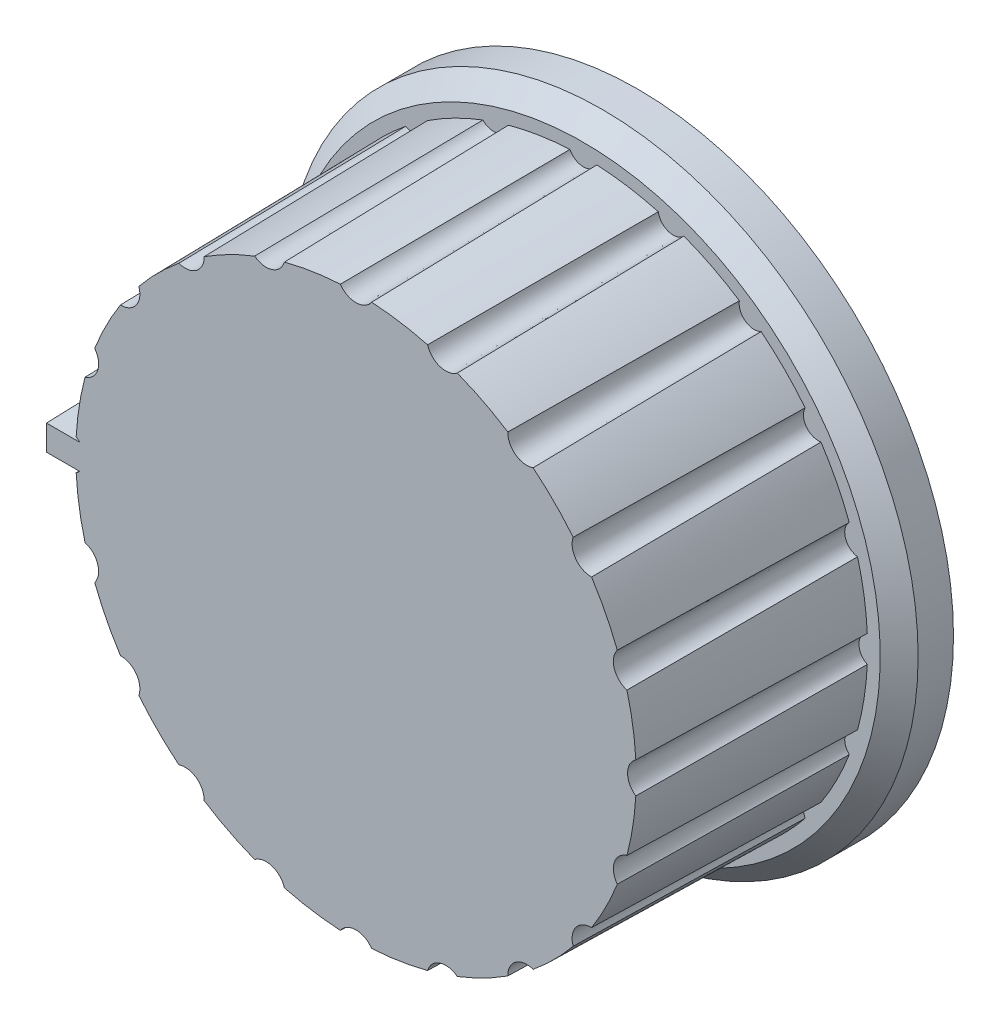
from build123d import *

# Parameters (mm, degrees)
SKETCH1_R                     = 25
BOSS_EXTRUDE1_DEPTH           = 4.3
SKETCH2_R                     = 22.5
BOSS_EXTRUDE2_DEPTH           = 18
BOSS_EXTRUDE2_TAPER           = 1
CHAMFER1_SIZE                 = 1.5
SKETCH3_R                     = 1.5
CUT_EXTRUDE2_DEPTH            = 18
CUT_EXTRUDE2_DRAFT            = -1
CUT_EXTRUDE2_PROFILE_2_DEPTH  = 18
CUT_EXTRUDE2_PROFILE_2_DRAFT  = -1
CUT_EXTRUDE2_PROFILE_3_DEPTH  = 18
CUT_EXTRUDE2_PROFILE_3_DRAFT  = -1
CUT_EXTRUDE2_PROFILE_4_DEPTH  = 18
CUT_EXTRUDE2_PROFILE_4_DRAFT  = -1
CUT_EXTRUDE2_PROFILE_5_DEPTH  = 18
CUT_EXTRUDE2_PROFILE_5_DRAFT  = -1
CUT_EXTRUDE2_PROFILE_6_DEPTH  = 18
CUT_EXTRUDE2_PROFILE_6_DRAFT  = -1
CUT_EXTRUDE2_PROFILE_7_DEPTH  = 18
CUT_EXTRUDE2_PROFILE_7_DRAFT  = -1
CUT_EXTRUDE2_PROFILE_8_DEPTH  = 18
CUT_EXTRUDE2_PROFILE_8_DRAFT  = -1
CUT_EXTRUDE2_PROFILE_9_DEPTH  = 18
CUT_EXTRUDE2_PROFILE_9_DRAFT  = -1
CUT_EXTRUDE2_PROFILE_10_DEPTH = 18
CUT_EXTRUDE2_PROFILE_10_DRAFT = -1
CUT_EXTRUDE2_PROFILE_11_DEPTH = 18
CUT_EXTRUDE2_PROFILE_11_DRAFT = -1
CUT_EXTRUDE2_PROFILE_12_DEPTH = 18
CUT_EXTRUDE2_PROFILE_12_DRAFT = -1
CUT_EXTRUDE2_PROFILE_13_DEPTH = 18
CUT_EXTRUDE2_PROFILE_13_DRAFT = -1
CUT_EXTRUDE2_PROFILE_14_DEPTH = 18
CUT_EXTRUDE2_PROFILE_14_DRAFT = -1
CUT_EXTRUDE2_PROFILE_15_DEPTH = 18
CUT_EXTRUDE2_PROFILE_15_DRAFT = -1
CUT_EXTRUDE2_PROFILE_16_DEPTH = 18
CUT_EXTRUDE2_PROFILE_16_DRAFT = -1
CUT_EXTRUDE2_PROFILE_17_DEPTH = 18
CUT_EXTRUDE2_PROFILE_17_DRAFT = -1
CUT_EXTRUDE2_PROFILE_18_DEPTH = 18
CUT_EXTRUDE2_PROFILE_18_DRAFT = -1
CUT_EXTRUDE2_PROFILE_19_DEPTH = 18
CUT_EXTRUDE2_PROFILE_19_DRAFT = -1
CUT_EXTRUDE2_PROFILE_20_DEPTH = 18
CUT_EXTRUDE2_PROFILE_20_DRAFT = -1
SKETCH4_W                     = 7
SKETCH4_H                     = 2
BOSS_EXTRUDE3_DEPTH           = 21
BOSS_EXTRUDE3_DRAFT           = 1
SKETCH5_R                     = 5.9
CUT_EXTRUDE3_DEPTH            = 3
SKETCH7_R                     = 3
CUT_EXTRUDE4_DEPTH            = 11
SKETCH8_W                     = 5.946427498
SKETCH8_H                     = 0.8
BOSS_EXTRUDE4_DEPTH           = 12


with BuildPart() as part:
    # Sketch1 → Boss-Extrude1 (new body)
    with BuildSketch(Plane.XY):
        with Locations(Location((0, 0, 0), (0, 0, 180))):
            Circle(SKETCH1_R)
    extrude(amount=BOSS_EXTRUDE1_DEPTH)

    # Sketch2 → Boss-Extrude2 (add)
    with BuildSketch(Plane.XY.offset(4.3)):
        Circle(SKETCH2_R)
    extrude(amount=BOSS_EXTRUDE2_DEPTH, taper=BOSS_EXTRUDE2_TAPER)

    # Chamfer1
    chamfer1_edges = [part.edges().sort_by_distance(p)[0] for p in [
        (25, 0, 4.3),
    ]]
    chamfer(chamfer1_edges, length=CHAMFER1_SIZE)


with BuildPart() as cut_extrude2_tool:
    # Sketch3 → Cut-Extrude2 (with draft: the straight prism first)
    with BuildSketch(Plane.XY.offset(22.3)):
        with Locations((0, 23)):
            Circle(SKETCH3_R)
    extrude(amount=-CUT_EXTRUDE2_DEPTH)
    # Cut-Extrude2: the draft: its side faces are tilted about the plane it starts from
    cut_extrude2_sides = [cut_extrude2_tool.faces().sort_by_distance(p)[0] for p in [
        (-1.5, 23, 13.3),
    ]]
    draft(cut_extrude2_sides, Plane.XY.offset(22.3), CUT_EXTRUDE2_DRAFT)


with BuildPart() as part_1:
    add(part.part)

    # Cut-Extrude2: cut by cut_extrude2_tool
    add(cut_extrude2_tool.part, mode=Mode.SUBTRACT)


with BuildPart() as cut_extrude2_profile_2_tool:
    # Sketch3 → Cut-Extrude2 profile 2 (with draft: the straight prism first)
    with BuildSketch(Plane.XY.offset(22.3)):
        with Locations((7.107390871, 21.874299875)):
            Circle(SKETCH3_R)
    extrude(amount=-CUT_EXTRUDE2_PROFILE_2_DEPTH)
    # Cut-Extrude2 profile 2: the draft: its side faces are tilted about the plane it starts from
    cut_extrude2_profile_2_sides = [cut_extrude2_profile_2_tool.faces().sort_by_distance(p)[0] for p in [
        (5.607390871, 21.874299875, 13.3),
    ]]
    draft(cut_extrude2_profile_2_sides, Plane.XY.offset(22.3), CUT_EXTRUDE2_PROFILE_2_DRAFT)


with BuildPart() as part_2:
    add(part_1.part)

    # Cut-Extrude2 profile 2: cut by cut_extrude2_profile_2_tool
    add(cut_extrude2_profile_2_tool.part, mode=Mode.SUBTRACT)


with BuildPart() as cut_extrude2_profile_3_tool:
    # Sketch3 → Cut-Extrude2 profile 3 (with draft: the straight prism first)
    with BuildSketch(Plane.XY.offset(22.3)):
        with Locations((13.519060803, 18.607390871)):
            Circle(SKETCH3_R)
    extrude(amount=-CUT_EXTRUDE2_PROFILE_3_DEPTH)
    # Cut-Extrude2 profile 3: the draft: its side faces are tilted about the plane it starts from
    cut_extrude2_profile_3_sides = [cut_extrude2_profile_3_tool.faces().sort_by_distance(p)[0] for p in [
        (12.019060803, 18.607390871, 13.3),
    ]]
    draft(cut_extrude2_profile_3_sides, Plane.XY.offset(22.3), CUT_EXTRUDE2_PROFILE_3_DRAFT)


with BuildPart() as part_3:
    add(part_2.part)

    # Cut-Extrude2 profile 3: cut by cut_extrude2_profile_3_tool
    add(cut_extrude2_profile_3_tool.part, mode=Mode.SUBTRACT)


with BuildPart() as cut_extrude2_profile_4_tool:
    # Sketch3 → Cut-Extrude2 profile 4 (with draft: the straight prism first)
    with BuildSketch(Plane.XY.offset(22.3)):
        with Locations((18.607390871, 13.519060803)):
            Circle(SKETCH3_R)
    extrude(amount=-CUT_EXTRUDE2_PROFILE_4_DEPTH)
    # Cut-Extrude2 profile 4: the draft: its side faces are tilted about the plane it starts from
    cut_extrude2_profile_4_sides = [cut_extrude2_profile_4_tool.faces().sort_by_distance(p)[0] for p in [
        (17.107390871, 13.519060803, 13.3),
    ]]
    draft(cut_extrude2_profile_4_sides, Plane.XY.offset(22.3), CUT_EXTRUDE2_PROFILE_4_DRAFT)


with BuildPart() as part_4:
    add(part_3.part)

    # Cut-Extrude2 profile 4: cut by cut_extrude2_profile_4_tool
    add(cut_extrude2_profile_4_tool.part, mode=Mode.SUBTRACT)


with BuildPart() as cut_extrude2_profile_5_tool:
    # Sketch3 → Cut-Extrude2 profile 5 (with draft: the straight prism first)
    with BuildSketch(Plane.XY.offset(22.3)):
        with Locations((21.874299875, 7.107390871)):
            Circle(SKETCH3_R)
    extrude(amount=-CUT_EXTRUDE2_PROFILE_5_DEPTH)
    # Cut-Extrude2 profile 5: the draft: its side faces are tilted about the plane it starts from
    cut_extrude2_profile_5_sides = [cut_extrude2_profile_5_tool.faces().sort_by_distance(p)[0] for p in [
        (20.374299875, 7.107390871, 13.3),
    ]]
    draft(cut_extrude2_profile_5_sides, Plane.XY.offset(22.3), CUT_EXTRUDE2_PROFILE_5_DRAFT)


with BuildPart() as part_5:
    add(part_4.part)

    # Cut-Extrude2 profile 5: cut by cut_extrude2_profile_5_tool
    add(cut_extrude2_profile_5_tool.part, mode=Mode.SUBTRACT)


with BuildPart() as cut_extrude2_profile_6_tool:
    # Sketch3 → Cut-Extrude2 profile 6 (with draft: the straight prism first)
    with BuildSketch(Plane.XY.offset(22.3)):
        with Locations((23, 0)):
            Circle(SKETCH3_R)
    extrude(amount=-CUT_EXTRUDE2_PROFILE_6_DEPTH)
    # Cut-Extrude2 profile 6: the draft: its side faces are tilted about the plane it starts from
    cut_extrude2_profile_6_sides = [cut_extrude2_profile_6_tool.faces().sort_by_distance(p)[0] for p in [
        (21.5, 0, 13.3),
    ]]
    draft(cut_extrude2_profile_6_sides, Plane.XY.offset(22.3), CUT_EXTRUDE2_PROFILE_6_DRAFT)


with BuildPart() as part_6:
    add(part_5.part)

    # Cut-Extrude2 profile 6: cut by cut_extrude2_profile_6_tool
    add(cut_extrude2_profile_6_tool.part, mode=Mode.SUBTRACT)


with BuildPart() as cut_extrude2_profile_7_tool:
    # Sketch3 → Cut-Extrude2 profile 7 (with draft: the straight prism first)
    with BuildSketch(Plane.XY.offset(22.3)):
        with Locations((21.874299875, -7.107390871)):
            Circle(SKETCH3_R)
    extrude(amount=-CUT_EXTRUDE2_PROFILE_7_DEPTH)
    # Cut-Extrude2 profile 7: the draft: its side faces are tilted about the plane it starts from
    cut_extrude2_profile_7_sides = [cut_extrude2_profile_7_tool.faces().sort_by_distance(p)[0] for p in [
        (20.374299875, -7.107390871, 13.3),
    ]]
    draft(cut_extrude2_profile_7_sides, Plane.XY.offset(22.3), CUT_EXTRUDE2_PROFILE_7_DRAFT)


with BuildPart() as part_7:
    add(part_6.part)

    # Cut-Extrude2 profile 7: cut by cut_extrude2_profile_7_tool
    add(cut_extrude2_profile_7_tool.part, mode=Mode.SUBTRACT)


with BuildPart() as cut_extrude2_profile_8_tool:
    # Sketch3 → Cut-Extrude2 profile 8 (with draft: the straight prism first)
    with BuildSketch(Plane.XY.offset(22.3)):
        with Locations((18.607390871, -13.519060803)):
            Circle(SKETCH3_R)
    extrude(amount=-CUT_EXTRUDE2_PROFILE_8_DEPTH)
    # Cut-Extrude2 profile 8: the draft: its side faces are tilted about the plane it starts from
    cut_extrude2_profile_8_sides = [cut_extrude2_profile_8_tool.faces().sort_by_distance(p)[0] for p in [
        (17.107390871, -13.519060803, 13.3),
    ]]
    draft(cut_extrude2_profile_8_sides, Plane.XY.offset(22.3), CUT_EXTRUDE2_PROFILE_8_DRAFT)


with BuildPart() as part_8:
    add(part_7.part)

    # Cut-Extrude2 profile 8: cut by cut_extrude2_profile_8_tool
    add(cut_extrude2_profile_8_tool.part, mode=Mode.SUBTRACT)


with BuildPart() as cut_extrude2_profile_9_tool:
    # Sketch3 → Cut-Extrude2 profile 9 (with draft: the straight prism first)
    with BuildSketch(Plane.XY.offset(22.3)):
        with Locations((13.519060803, -18.607390871)):
            Circle(SKETCH3_R)
    extrude(amount=-CUT_EXTRUDE2_PROFILE_9_DEPTH)
    # Cut-Extrude2 profile 9: the draft: its side faces are tilted about the plane it starts from
    cut_extrude2_profile_9_sides = [cut_extrude2_profile_9_tool.faces().sort_by_distance(p)[0] for p in [
        (12.019060803, -18.607390871, 13.3),
    ]]
    draft(cut_extrude2_profile_9_sides, Plane.XY.offset(22.3), CUT_EXTRUDE2_PROFILE_9_DRAFT)


with BuildPart() as part_9:
    add(part_8.part)

    # Cut-Extrude2 profile 9: cut by cut_extrude2_profile_9_tool
    add(cut_extrude2_profile_9_tool.part, mode=Mode.SUBTRACT)


with BuildPart() as cut_extrude2_profile_10_tool:
    # Sketch3 → Cut-Extrude2 profile 10 (with draft: the straight prism first)
    with BuildSketch(Plane.XY.offset(22.3)):
        with Locations((7.107390871, -21.874299875)):
            Circle(SKETCH3_R)
    extrude(amount=-CUT_EXTRUDE2_PROFILE_10_DEPTH)
    # Cut-Extrude2 profile 10: the draft: its side faces are tilted about the plane it starts from
    cut_extrude2_profile_10_sides = [cut_extrude2_profile_10_tool.faces().sort_by_distance(p)[0] for p in [
        (5.607390871, -21.874299875, 13.3),
    ]]
    draft(cut_extrude2_profile_10_sides, Plane.XY.offset(22.3), CUT_EXTRUDE2_PROFILE_10_DRAFT)


with BuildPart() as part_10:
    add(part_9.part)

    # Cut-Extrude2 profile 10: cut by cut_extrude2_profile_10_tool
    add(cut_extrude2_profile_10_tool.part, mode=Mode.SUBTRACT)


with BuildPart() as cut_extrude2_profile_11_tool:
    # Sketch3 → Cut-Extrude2 profile 11 (with draft: the straight prism first)
    with BuildSketch(Plane.XY.offset(22.3)):
        with Locations((0, -23)):
            Circle(SKETCH3_R)
    extrude(amount=-CUT_EXTRUDE2_PROFILE_11_DEPTH)
    # Cut-Extrude2 profile 11: the draft: its side faces are tilted about the plane it starts from
    cut_extrude2_profile_11_sides = [cut_extrude2_profile_11_tool.faces().sort_by_distance(p)[0] for p in [
        (-1.5, -23, 13.3),
    ]]
    draft(cut_extrude2_profile_11_sides, Plane.XY.offset(22.3), CUT_EXTRUDE2_PROFILE_11_DRAFT)


with BuildPart() as part_11:
    add(part_10.part)

    # Cut-Extrude2 profile 11: cut by cut_extrude2_profile_11_tool
    add(cut_extrude2_profile_11_tool.part, mode=Mode.SUBTRACT)


with BuildPart() as cut_extrude2_profile_12_tool:
    # Sketch3 → Cut-Extrude2 profile 12 (with draft: the straight prism first)
    with BuildSketch(Plane.XY.offset(22.3)):
        with Locations((-7.107390871, -21.874299875)):
            Circle(SKETCH3_R)
    extrude(amount=-CUT_EXTRUDE2_PROFILE_12_DEPTH)
    # Cut-Extrude2 profile 12: the draft: its side faces are tilted about the plane it starts from
    cut_extrude2_profile_12_sides = [cut_extrude2_profile_12_tool.faces().sort_by_distance(p)[0] for p in [
        (-8.607390871, -21.874299875, 13.3),
    ]]
    draft(cut_extrude2_profile_12_sides, Plane.XY.offset(22.3), CUT_EXTRUDE2_PROFILE_12_DRAFT)


with BuildPart() as part_12:
    add(part_11.part)

    # Cut-Extrude2 profile 12: cut by cut_extrude2_profile_12_tool
    add(cut_extrude2_profile_12_tool.part, mode=Mode.SUBTRACT)


with BuildPart() as cut_extrude2_profile_13_tool:
    # Sketch3 → Cut-Extrude2 profile 13 (with draft: the straight prism first)
    with BuildSketch(Plane.XY.offset(22.3)):
        with Locations((-13.519060803, -18.607390871)):
            Circle(SKETCH3_R)
    extrude(amount=-CUT_EXTRUDE2_PROFILE_13_DEPTH)
    # Cut-Extrude2 profile 13: the draft: its side faces are tilted about the plane it starts from
    cut_extrude2_profile_13_sides = [cut_extrude2_profile_13_tool.faces().sort_by_distance(p)[0] for p in [
        (-15.019060803, -18.607390871, 13.3),
    ]]
    draft(cut_extrude2_profile_13_sides, Plane.XY.offset(22.3), CUT_EXTRUDE2_PROFILE_13_DRAFT)


with BuildPart() as part_13:
    add(part_12.part)

    # Cut-Extrude2 profile 13: cut by cut_extrude2_profile_13_tool
    add(cut_extrude2_profile_13_tool.part, mode=Mode.SUBTRACT)


with BuildPart() as cut_extrude2_profile_14_tool:
    # Sketch3 → Cut-Extrude2 profile 14 (with draft: the straight prism first)
    with BuildSketch(Plane.XY.offset(22.3)):
        with Locations((-18.607390871, -13.519060803)):
            Circle(SKETCH3_R)
    extrude(amount=-CUT_EXTRUDE2_PROFILE_14_DEPTH)
    # Cut-Extrude2 profile 14: the draft: its side faces are tilted about the plane it starts from
    cut_extrude2_profile_14_sides = [cut_extrude2_profile_14_tool.faces().sort_by_distance(p)[0] for p in [
        (-20.107390871, -13.519060803, 13.3),
    ]]
    draft(cut_extrude2_profile_14_sides, Plane.XY.offset(22.3), CUT_EXTRUDE2_PROFILE_14_DRAFT)


with BuildPart() as part_14:
    add(part_13.part)

    # Cut-Extrude2 profile 14: cut by cut_extrude2_profile_14_tool
    add(cut_extrude2_profile_14_tool.part, mode=Mode.SUBTRACT)


with BuildPart() as cut_extrude2_profile_15_tool:
    # Sketch3 → Cut-Extrude2 profile 15 (with draft: the straight prism first)
    with BuildSketch(Plane.XY.offset(22.3)):
        with Locations((-21.874299875, -7.107390871)):
            Circle(SKETCH3_R)
    extrude(amount=-CUT_EXTRUDE2_PROFILE_15_DEPTH)
    # Cut-Extrude2 profile 15: the draft: its side faces are tilted about the plane it starts from
    cut_extrude2_profile_15_sides = [cut_extrude2_profile_15_tool.faces().sort_by_distance(p)[0] for p in [
        (-23.374299875, -7.107390871, 13.3),
    ]]
    draft(cut_extrude2_profile_15_sides, Plane.XY.offset(22.3), CUT_EXTRUDE2_PROFILE_15_DRAFT)


with BuildPart() as part_15:
    add(part_14.part)

    # Cut-Extrude2 profile 15: cut by cut_extrude2_profile_15_tool
    add(cut_extrude2_profile_15_tool.part, mode=Mode.SUBTRACT)


with BuildPart() as cut_extrude2_profile_16_tool:
    # Sketch3 → Cut-Extrude2 profile 16 (with draft: the straight prism first)
    with BuildSketch(Plane.XY.offset(22.3)):
        with Locations((-23, 0)):
            Circle(SKETCH3_R)
    extrude(amount=-CUT_EXTRUDE2_PROFILE_16_DEPTH)
    # Cut-Extrude2 profile 16: the draft: its side faces are tilted about the plane it starts from
    cut_extrude2_profile_16_sides = [cut_extrude2_profile_16_tool.faces().sort_by_distance(p)[0] for p in [
        (-24.5, 0, 13.3),
    ]]
    draft(cut_extrude2_profile_16_sides, Plane.XY.offset(22.3), CUT_EXTRUDE2_PROFILE_16_DRAFT)


with BuildPart() as part_16:
    add(part_15.part)

    # Cut-Extrude2 profile 16: cut by cut_extrude2_profile_16_tool
    add(cut_extrude2_profile_16_tool.part, mode=Mode.SUBTRACT)


with BuildPart() as cut_extrude2_profile_17_tool:
    # Sketch3 → Cut-Extrude2 profile 17 (with draft: the straight prism first)
    with BuildSketch(Plane.XY.offset(22.3)):
        with Locations((-21.874299875, 7.107390871)):
            Circle(SKETCH3_R)
    extrude(amount=-CUT_EXTRUDE2_PROFILE_17_DEPTH)
    # Cut-Extrude2 profile 17: the draft: its side faces are tilted about the plane it starts from
    cut_extrude2_profile_17_sides = [cut_extrude2_profile_17_tool.faces().sort_by_distance(p)[0] for p in [
        (-23.374299875, 7.107390871, 13.3),
    ]]
    draft(cut_extrude2_profile_17_sides, Plane.XY.offset(22.3), CUT_EXTRUDE2_PROFILE_17_DRAFT)


with BuildPart() as part_17:
    add(part_16.part)

    # Cut-Extrude2 profile 17: cut by cut_extrude2_profile_17_tool
    add(cut_extrude2_profile_17_tool.part, mode=Mode.SUBTRACT)


with BuildPart() as cut_extrude2_profile_18_tool:
    # Sketch3 → Cut-Extrude2 profile 18 (with draft: the straight prism first)
    with BuildSketch(Plane.XY.offset(22.3)):
        with Locations((-18.607390871, 13.519060803)):
            Circle(SKETCH3_R)
    extrude(amount=-CUT_EXTRUDE2_PROFILE_18_DEPTH)
    # Cut-Extrude2 profile 18: the draft: its side faces are tilted about the plane it starts from
    cut_extrude2_profile_18_sides = [cut_extrude2_profile_18_tool.faces().sort_by_distance(p)[0] for p in [
        (-20.107390871, 13.519060803, 13.3),
    ]]
    draft(cut_extrude2_profile_18_sides, Plane.XY.offset(22.3), CUT_EXTRUDE2_PROFILE_18_DRAFT)


with BuildPart() as part_18:
    add(part_17.part)

    # Cut-Extrude2 profile 18: cut by cut_extrude2_profile_18_tool
    add(cut_extrude2_profile_18_tool.part, mode=Mode.SUBTRACT)


with BuildPart() as cut_extrude2_profile_19_tool:
    # Sketch3 → Cut-Extrude2 profile 19 (with draft: the straight prism first)
    with BuildSketch(Plane.XY.offset(22.3)):
        with Locations((-13.519060803, 18.607390871)):
            Circle(SKETCH3_R)
    extrude(amount=-CUT_EXTRUDE2_PROFILE_19_DEPTH)
    # Cut-Extrude2 profile 19: the draft: its side faces are tilted about the plane it starts from
    cut_extrude2_profile_19_sides = [cut_extrude2_profile_19_tool.faces().sort_by_distance(p)[0] for p in [
        (-15.019060803, 18.607390871, 13.3),
    ]]
    draft(cut_extrude2_profile_19_sides, Plane.XY.offset(22.3), CUT_EXTRUDE2_PROFILE_19_DRAFT)


with BuildPart() as part_19:
    add(part_18.part)

    # Cut-Extrude2 profile 19: cut by cut_extrude2_profile_19_tool
    add(cut_extrude2_profile_19_tool.part, mode=Mode.SUBTRACT)


with BuildPart() as cut_extrude2_profile_20_tool:
    # Sketch3 → Cut-Extrude2 profile 20 (with draft: the straight prism first)
    with BuildSketch(Plane.XY.offset(22.3)):
        with Locations((-7.107390871, 21.874299875)):
            Circle(SKETCH3_R)
    extrude(amount=-CUT_EXTRUDE2_PROFILE_20_DEPTH)
    # Cut-Extrude2 profile 20: the draft: its side faces are tilted about the plane it starts from
    cut_extrude2_profile_20_sides = [cut_extrude2_profile_20_tool.faces().sort_by_distance(p)[0] for p in [
        (-8.607390871, 21.874299875, 13.3),
    ]]
    draft(cut_extrude2_profile_20_sides, Plane.XY.offset(22.3), CUT_EXTRUDE2_PROFILE_20_DRAFT)


with BuildPart() as part_20:
    add(part_19.part)

    # Cut-Extrude2 profile 20: cut by cut_extrude2_profile_20_tool
    add(cut_extrude2_profile_20_tool.part, mode=Mode.SUBTRACT)


with BuildPart() as boss_extrude3_tool:
    # Sketch4 → Boss-Extrude3 (with draft: the straight prism first)
    with BuildSketch(Plane.XY.offset(22.3)):
        with Locations((-21, 0)):
            Rectangle(SKETCH4_W, SKETCH4_H)
    extrude(amount=-BOSS_EXTRUDE3_DEPTH)
    # Boss-Extrude3: the draft: its side faces are tilted about the plane it starts from
    boss_extrude3_sides = [boss_extrude3_tool.faces().sort_by_distance(p)[0] for p in [
        (-24.5, 0, 11.8),
        (-21, -1, 11.8),
        (-17.5, 0, 11.8),
        (-21, 1, 11.8),
    ]]
    draft(boss_extrude3_sides, Plane.XY.offset(22.3), BOSS_EXTRUDE3_DRAFT)


with BuildPart() as part_21:
    add(part_20.part)

    # Boss-Extrude3: add boss_extrude3_tool
    add(boss_extrude3_tool.part)

    # Sketch5 → Cut-Extrude3 (cut)
    with BuildSketch(Plane(origin=(0, 0, 0), x_dir=(-1, 0, 0), z_dir=(0, 0, -1))):
        Circle(SKETCH5_R)
    extrude(amount=-CUT_EXTRUDE3_DEPTH, mode=Mode.SUBTRACT)

    # Sketch7 → Cut-Extrude4 (cut)
    with BuildSketch(Plane(origin=(0, 0, 3), x_dir=(-1, 0, 0), z_dir=(0, 0, -1))):
        Circle(SKETCH7_R)
    extrude(amount=-CUT_EXTRUDE4_DEPTH, mode=Mode.SUBTRACT)


with BuildPart() as body_2:
    # Sketch8 → Boss-Extrude4 (new body)
    with BuildSketch(Plane(origin=(0, 0, 3), x_dir=(-1, 0, 0), z_dir=(0, 0, -1))):
        Rectangle(SKETCH8_W, SKETCH8_H)
    extrude(amount=-BOSS_EXTRUDE4_DEPTH)


solid = Compound([part_21.part, body_2.part])
